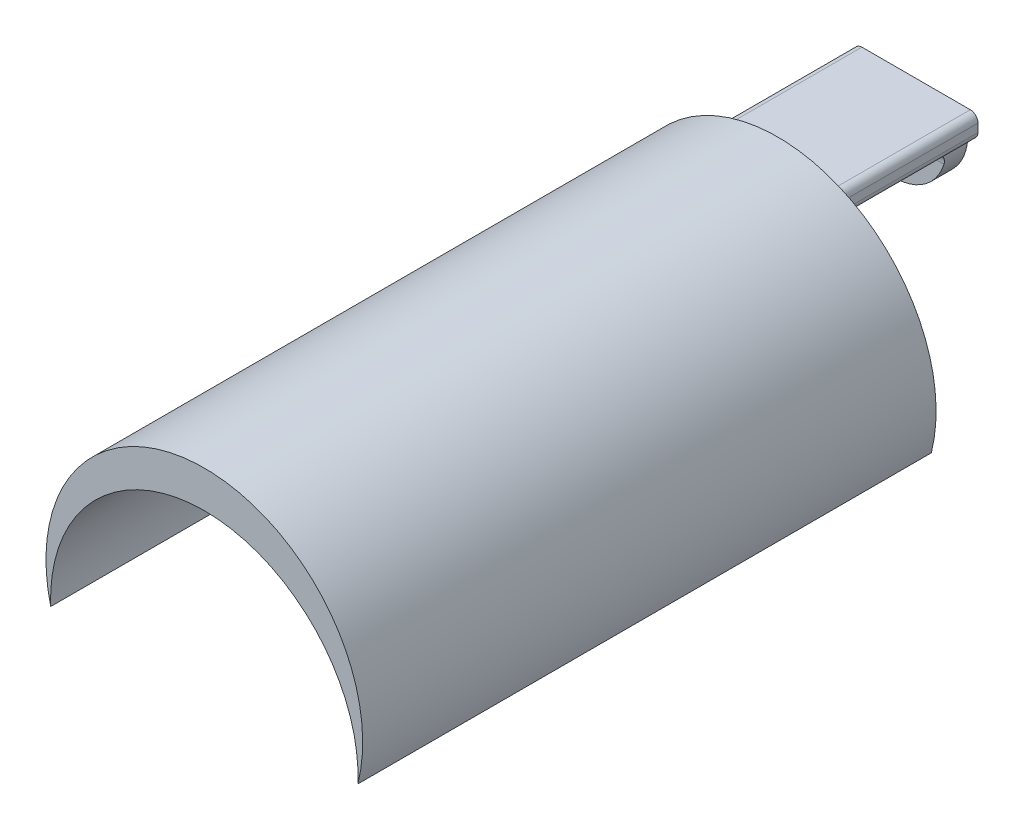
from build123d import *

# Parameters (mm, degrees)
SKETCH1_R           = 26.162
BOSS_EXTRUDE1_DEPTH = 94.742
SKETCH2_R           = 25.4
CUT_EXTRUDE1_DEPTH  = 35.052
SKETCH3_R           = 20.066
CUT_EXTRUDE2_DEPTH  = 134.62
SKETCH6_W           = 64.219899477
SKETCH6_H           = 22.849587553
CUT_EXTRUDE4_DEPTH  = 33.909
BOSS_EXTRUDE3_DEPTH = 22.86
BOSS_EXTRUDE4_DEPTH = 3.556
FILLET3_R           = 2.54
FILLET4_R           = 0.254


with BuildPart() as part:
    # Sketch1 → Boss-Extrude1 (new body)
    with BuildSketch(Plane.XY):
        Circle(SKETCH1_R)
    extrude(amount=BOSS_EXTRUDE1_DEPTH)

    # Sketch2 → Cut-Extrude1 (cut)
    with BuildSketch(Plane.XY.offset(94.742)):
        with Locations((0, -5.334)):
            Circle(SKETCH2_R)
    extrude(amount=-CUT_EXTRUDE1_DEPTH, mode=Mode.SUBTRACT)

    # Sketch3 → Cut-Extrude2 (cut)
    with BuildSketch(Plane.XY.offset(59.69)):
        with Locations((0, -3.339145452)):
            Circle(SKETCH3_R)
    extrude(amount=-CUT_EXTRUDE2_DEPTH, mode=Mode.SUBTRACT)

    # Sketch6 → Cut-Extrude4 (cut, symmetric)
    with BuildSketch(Plane(origin=(0, 0, 0), x_dir=(0, 0, -1), z_dir=(1, 0, 0))):
        with Locations((-27.580050262, -17.774793777)):
            Rectangle(SKETCH6_W, SKETCH6_H)
    extrude(amount=CUT_EXTRUDE4_DEPTH, both=True, mode=Mode.SUBTRACT)

    # Sketch11 → Boss-Extrude3 (add)
    with BuildSketch(Plane(origin=(0, 0, 0), x_dir=(-1, 0, 0), z_dir=(0, 0, -1))):
        with BuildLine():
            Line((-8.957907595, 23.105072639), (8.957907595, 23.105072639))
            ThreePointArc((8.957907595, 23.105072639), (9.855933208, 22.733098251), (10.227907595, 21.835072639))
            Line((10.227907595, 21.835072639), (10.227907595, 20.473507992))
            ThreePointArc((10.227907595, 20.473507992), (9.855933208, 19.57548238), (8.957907595, 19.203507992))
            Line((8.957907595, 19.203507992), (-8.957907595, 19.203507992))
            ThreePointArc((-8.957907595, 19.203507992), (-9.855933208, 19.57548238), (-10.227907595, 20.473507992))
            Line((-10.227907595, 20.473507992), (-10.227907595, 21.835072639))
            ThreePointArc((-10.227907595, 21.835072639), (-9.855933208, 22.733098251), (-8.957907595, 23.105072639))
        make_face()
    extrude(amount=BOSS_EXTRUDE3_DEPTH)

    # Sketch12 → Boss-Extrude4 (add)
    with BuildSketch(Plane(origin=(0, 0, -22.86), x_dir=(-1, 0, 0), z_dir=(0, 0, -1))):
        with BuildLine():
            Line((-8.539617395, 19.203507992), (8.539617395, 19.203507992))
            ThreePointArc((8.539617395, 19.203507992), (0, 10.663890596), (-8.539617395, 19.203507992))
        make_face()
    extrude(amount=-BOSS_EXTRUDE4_DEPTH)

    # Fillet3
    fillet3_edges = [part.edges().sort_by_distance(p)[0] for p in [
        (0, 19.203507992, -19.304),
    ]]
    fillet(fillet3_edges, radius=FILLET3_R)

    # Fillet4
    fillet4_edges = [part.edges().sort_by_distance(p)[0] for p in [
        (8.539617395, 19.203507992, -19.812),
        (-8.539617395, 19.203507992, -19.812),
    ]]
    fillet(fillet4_edges, radius=FILLET4_R)


solid = part.part
